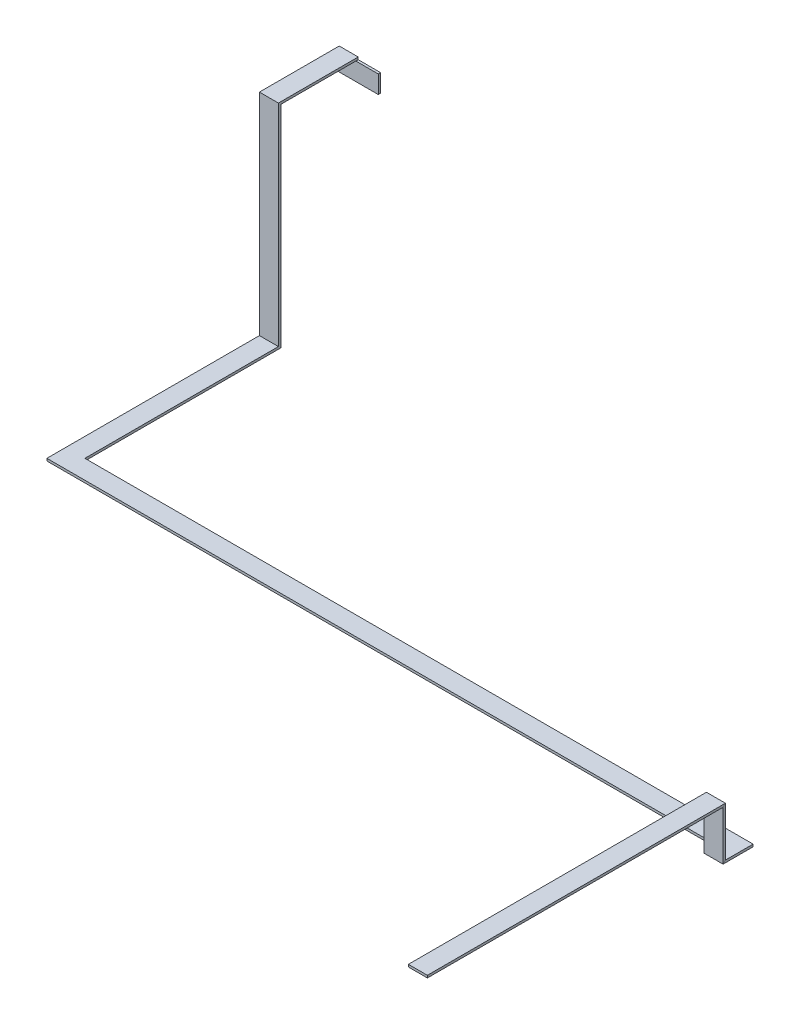
from build123d import *

# Parameters (mm, degrees)
CROQUIS2_W              = 50.8
CROQUIS2_H              = 570.39
SALIENTE_EXTRUIR1_DEPTH = 6.31
CROQUIS3_W              = 50.8
CROQUIS3_H              = 6.31
SALIENTE_EXTRUIR2_DEPTH = 568.44
CROQUIS4_W              = 50.8
CROQUIS4_H              = 6.31
SALIENTE_EXTRUIR3_DEPTH = 1787.3
CROQUIS6_W              = 50.8
CROQUIS6_H              = 6.31
CROQUIS7_W              = 60
CROQUIS7_H              = 53.955
SALIENTE_EXTRUIR4_DEPTH = 6.31
CROQUIS8_W              = 60
CROQUIS8_H              = 6.31
CORTAR_EXTRUIR1_DEPTH   = 6.31
CROQUIS9_W              = 50.8
CROQUIS9_H              = 6.31


with BuildPart() as part:
    # Croquis2 → Saliente-Extruir1 (new body)
    with BuildSketch(Plane.XY):
        Rectangle(CROQUIS2_W, CROQUIS2_H)
    extrude(amount=SALIENTE_EXTRUIR1_DEPTH)

    # Croquis3 → Saliente-Extruir2 (add)
    with BuildSketch(Plane.XY.offset(6.31)):
        with Locations((0, -282.04)):
            Rectangle(CROQUIS3_W, CROQUIS3_H)
    extrude(amount=SALIENTE_EXTRUIR2_DEPTH)

    # Croquis4 → Saliente-Extruir3 (add)
    with BuildSketch(Plane(origin=(25.4, 0, 0), x_dir=(0, 0, -1), z_dir=(1, 0, 0))):
        with Locations((-549.35, -282.04)):
            Rectangle(CROQUIS4_W, CROQUIS4_H)
    extrude(amount=SALIENTE_EXTRUIR3_DEPTH)

    # Barrer1: sweep along a curve in space
    with BuildLine() as barrer1_path:
        Line((0, 282.04, 0), (0, 282.04, -204))
        Line((0, 282.04, -204), (0, 231.24, -204))
    # Croquis6 → Barrer1 (sweep)
    with BuildSketch(Plane(origin=(0, 0, 0), x_dir=(-1, 0, 0), z_dir=(0, 0, -1))):
        with Locations((0, 282.04)):
            Rectangle(CROQUIS6_W, CROQUIS6_H)
    sweep(path=barrer1_path.line, transition=Transition.RIGHT)

    # Croquis7 → Saliente-Extruir4 (add)
    with BuildSketch(Plane(origin=(0, 0, -207.155), x_dir=(-1, 0, 0), z_dir=(0, 0, -1))):
        with Locations((-55.4, 258.2175)):
            Rectangle(CROQUIS7_W, CROQUIS7_H)
    extrude(amount=-SALIENTE_EXTRUIR4_DEPTH)

    # Croquis8 → Cortar-Extruir1 (cut)
    with BuildSketch(Plane.XY.offset(-200.845)):
        with Locations((55.4, 282.04)):
            Rectangle(CROQUIS8_W, CROQUIS8_H)
    extrude(amount=-CORTAR_EXTRUIR1_DEPTH, mode=Mode.SUBTRACT)

    # Barrer2: sweep along a curve in space
    with BuildLine() as barrer2_path:
        Line((1787.3, -282.04, 574.75), (1787.3, -282.04, 601.16))
        Line((1787.3, -282.04, 601.16), (1787.3, -150.28, 601.16))
        Line((1787.3, -150.28, 601.16), (1787.3, -150.28, 1395.16))
    # Croquis9 → Barrer2 (sweep)
    with BuildSketch(Plane.XY.offset(574.75)):
        with Locations((1787.3, -282.04)):
            Rectangle(CROQUIS9_W, CROQUIS9_H)
    sweep(path=barrer2_path.line, transition=Transition.RIGHT)


solid = part.part
